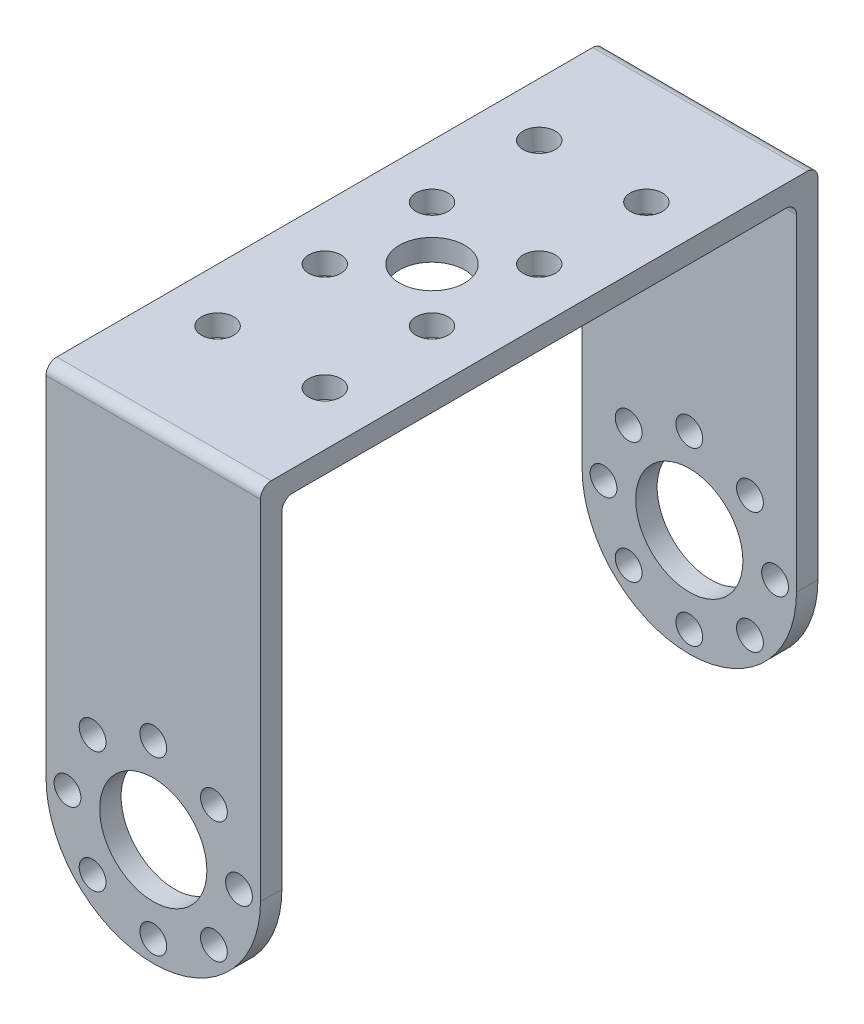
from build123d import *

# Parameters (mm, degrees)
EXTRUDE_1_DEPTH          = 20
FILLET_1_R               = 1
CUT_EXTRUDE_1_DEPTH      = 50000
SKETCH_3_R               = 5
CUT_EXTRUDE_2_DEPTH      = 500
SKETCH_4_R               = 1.25
CUT_EXTRUDE_3_DEPTH      = 5000
PATTERN_CIRCULAR_1_COUNT = 8
SKETCH_5_R               = 3.05
SKETCH_5_R_2             = 1.5
CUT_EXTRUDE_4_DEPTH      = 5000


with BuildPart() as part:
    # 草图1 → 凸台-拉伸1 (new body)
    with BuildSketch(Plane(origin=(0, 0, 0), x_dir=(0, 0, -1), z_dir=(1, 0, 0))):
        Polygon((-24, -25), (-24, 23), (24, 23), (24, -25), (26, -25), (26, 25), (-26, 25), (-26, -25), align=None)
    extrude(amount=EXTRUDE_1_DEPTH)

    # 圆角1
    fillet_1_edges = [part.edges().sort_by_distance(p)[0] for p in [
        (10, 23, -24),
        (10, 23, 24),
        (10, 25, 26),
        (10, 25, -26),
    ]]
    fillet(fillet_1_edges, radius=FILLET_1_R)

    # 草图2 → 切除-拉伸1 (cut)
    with BuildSketch(Plane.XY.offset(26)):
        with BuildLine():
            Line((0, -8.5), (0, -25))
            Line((0, -25), (20, -18.5))
            Line((20, -18.5), (20, -8.5))
            ThreePointArc((20, -8.5), (10, -18.5), (0, -8.5))
        make_face()
    extrude(amount=-CUT_EXTRUDE_1_DEPTH, mode=Mode.SUBTRACT)


with BuildPart() as cut_extrude_1_kept_piece:
    # of the separate pieces the step leaves, the one the design keeps (cut_extrude_1_pieces_kept)
    add(part.part.solids().sort_by_distance((0, -8.5, 24))[0])

    # 草图3 → 切除-拉伸2 (cut)
    with BuildSketch(Plane.XY.offset(26)):
        with Locations((10, -8.5)):
            Circle(SKETCH_3_R)
    extrude(amount=-CUT_EXTRUDE_2_DEPTH, mode=Mode.SUBTRACT)

    # 草图4 → 切除-拉伸3 (cut)
    with BuildSketch(Plane.XY.offset(26)):
        with Locations((18, -8.5)):
            Circle(SKETCH_4_R)
    cut_extrude_3 = extrude(amount=-CUT_EXTRUDE_3_DEPTH, mode=Mode.SUBTRACT)

    # 阵列(圆周)1: 切除-拉伸3 ×8 about axis
    pattern_circular_1_axis = Axis((10, -8.5, 0), (0, 0, 1))
    for i in range(1, PATTERN_CIRCULAR_1_COUNT):
        add(cut_extrude_3.rotate(pattern_circular_1_axis, i * 360 / PATTERN_CIRCULAR_1_COUNT), mode=Mode.SUBTRACT)

    # 草图5 → 切除-拉伸4 (cut)
    with BuildSketch(Plane(origin=(0, 25, 0), x_dir=(1, 0, 0), z_dir=(0, 1, 0))):
        with Locations(Location((10, 0, 0), (0, 0, 270))):
            Circle(SKETCH_5_R)
        with Locations(Location((15, 15, 0), (0, 0, 270))):
            Circle(SKETCH_5_R_2)
        with Locations(Location((5, 15, 0), (0, 0, 270))):
            Circle(SKETCH_5_R_2)
        with Locations(Location((5, 5, 0), (0, 0, 270))):
            Circle(SKETCH_5_R_2)
        with Locations(Location((15, 5, 0), (0, 0, 270))):
            Circle(SKETCH_5_R_2)
        with Locations(Location((15, -5, 0), (0, 0, 270))):
            Circle(SKETCH_5_R_2)
        with Locations(Location((5, -5, 0), (0, 0, 270))):
            Circle(SKETCH_5_R_2)
        with Locations(Location((5, -15, 0), (0, 0, 270))):
            Circle(SKETCH_5_R_2)
        with Locations(Location((15, -15, 0), (0, 0, 270))):
            Circle(SKETCH_5_R_2)
    extrude(amount=-CUT_EXTRUDE_4_DEPTH, mode=Mode.SUBTRACT)


solid = cut_extrude_1_kept_piece.part
